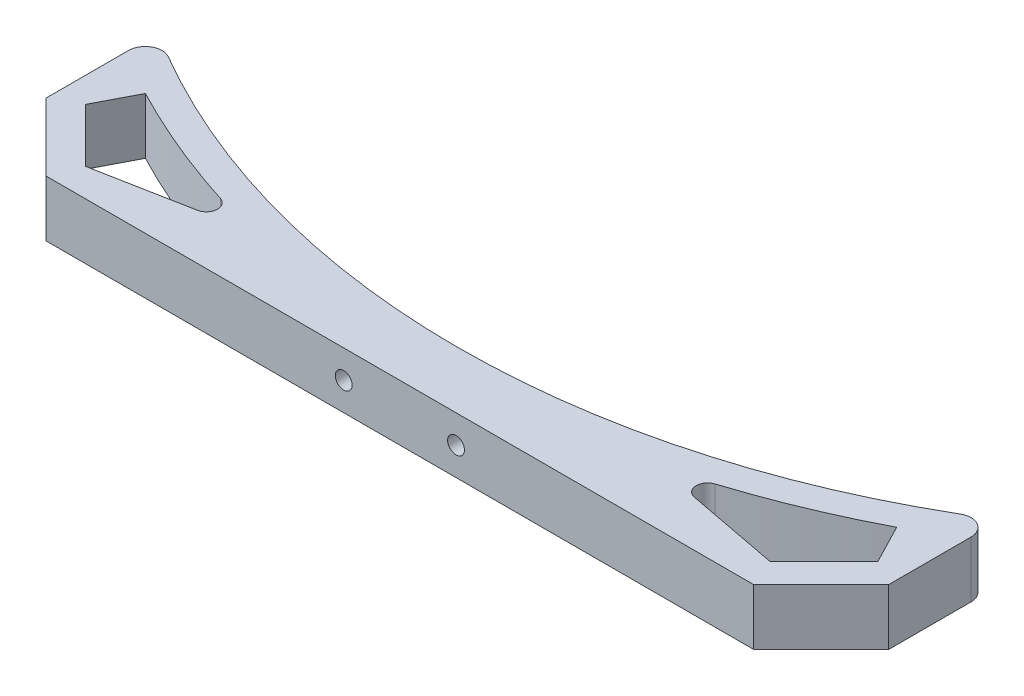
from build123d import *

# Parameters (mm, degrees)
EXTRUDE_1_DEPTH     = 10
CHAMFER_1_SIZE      = 15
FILLET_1_R          = 3
SKETCH_2_R          = 1.5
CUT_EXTRUDE_2_DEPTH = 78.661122835
SKETCH_4_R          = 3.5
CUT_EXTRUDE_3_DEPTH = 10
CUT_EXTRUDE_4_DEPTH = 78.661122848
FILLET_2_R          = 2
SKETCH_6_W          = 150
SKETCH_6_H          = 5.98
CUT_EXTRUDE_5_DEPTH = 78.661122848


with BuildPart() as part:
    # 草图1 → 凸台-拉伸1 (new body)
    with BuildSketch(Plane(origin=(0, 0, 0), x_dir=(1, 0, 0), z_dir=(0, 1, 0))):
        with BuildLine():
            Line((-75, -17.5), (75, -17.5))
            Line((75, -17.5), (75, 17.5))
            ThreePointArc((75, 17.5), (0, -4.284095825), (-75, 17.5))
            Line((-75, 17.5), (-75, -17.5))
        make_face()
    extrude(amount=EXTRUDE_1_DEPTH)

    # 倒角1
    chamfer_1_edges = [part.edges().sort_by_distance(p)[0] for p in [
        (75, 5, 17.5),
        (-75, 5, 17.5),
    ]]
    chamfer(chamfer_1_edges, length=CHAMFER_1_SIZE)

    # 圆角1
    fillet_1_edges = [part.edges().sort_by_distance(p)[0] for p in [
        (75, 5, -17.5),
        (-75, 5, -17.5),
    ]]
    fillet(fillet_1_edges, radius=FILLET_1_R)

    # 草图2 → 切除-拉伸2 (cut, through all)
    with BuildSketch(Plane.XY):
        with Locations(Location((10, 5, 0), (0, 0, 180))):
            Circle(SKETCH_2_R)
        with Locations(Location((-10, 5, 0), (0, 0, 180))):
            Circle(SKETCH_2_R)
    extrude(amount=CUT_EXTRUDE_2_DEPTH, mode=Mode.SUBTRACT)

    # 草图4 → 切除-拉伸3 (cut)
    with BuildSketch(Plane.XY):
        with Locations(Location((10, 5, 0), (0, 0, 180))):
            Circle(SKETCH_4_R)
        with Locations(Location((-10, 5, 0), (0, 0, 180))):
            Circle(SKETCH_4_R)
    extrude(amount=CUT_EXTRUDE_3_DEPTH, mode=Mode.SUBTRACT)

    # 草图5 → 切除-拉伸4 (cut, through all)
    with BuildSketch(Plane.XZ):
        with BuildLine():
            ThreePointArc((-36, 4.744054532), (-51.772161826, -0.273505866), (-66.86977855, -7.055759932))
            Line((-66.86977855, -7.055759932), (-70.5, -0.071067812))
            Line((-70.5, -0.071067812), (-60.928932188, 9.5))
            Line((-60.928932188, 9.5), (-36, 4.744054532))
        make_face()
        with BuildLine():
            Line((60.928932188, 9.5), (36, 4.744054532))
            ThreePointArc((36, 4.744054532), (51.772161826, -0.273505866), (66.86977855, -7.055759932))
            Line((66.86977855, -7.055759932), (70.5, -0.071067812))
            Line((70.5, -0.071067812), (60.928932188, 9.5))
        make_face()
    extrude(amount=-CUT_EXTRUDE_4_DEPTH, mode=Mode.SUBTRACT)

    # 圆角2
    fillet_2_edges = [part.edges().sort_by_distance(p)[0] for p in [
        (-36, 5, 4.744054532),
        (36, 5, 4.744054532),
    ]]
    fillet(fillet_2_edges, radius=FILLET_2_R)

    # 草图6 → 切除-拉伸5 (cut, through all)
    with BuildSketch(Plane.XZ):
        with Locations((0, 17.5)):
            Rectangle(SKETCH_6_W, SKETCH_6_H)
    extrude(amount=-CUT_EXTRUDE_5_DEPTH, mode=Mode.SUBTRACT)


solid = part.part
